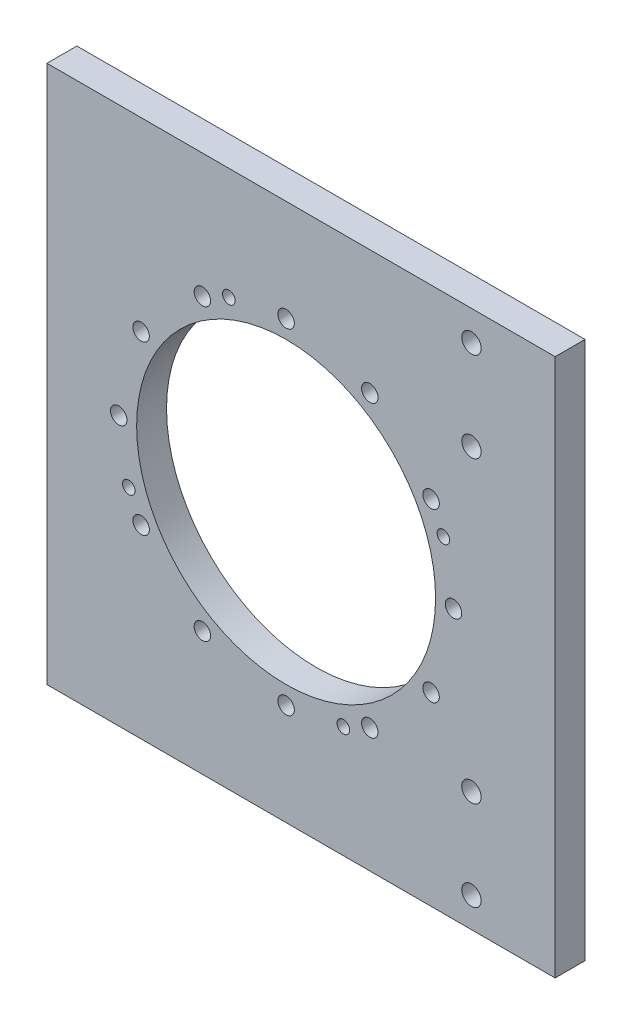
from build123d import *

# Parameters (mm, degrees)
SKETCH_1_W          = 170
SKETCH_1_H          = 180
EXTRUDE_1_DEPTH     = 10
SKETCH_2_R          = 50
SKETCH_2_R_2        = 2.75
SKETCH_2_R_3        = 2.1
SKETCH_2_R_4        = 3.25
CUT_EXTRUDE_1_DEPTH = 11


with BuildPart() as part:
    # 草图1 → 凸台-拉伸1 (new body)
    with BuildSketch(Plane.XY):
        with Locations((5, 0)):
            Rectangle(SKETCH_1_W, SKETCH_1_H)
    extrude(amount=EXTRUDE_1_DEPTH)

    # 草图2 → 切除-拉伸1 (cut)
    with BuildSketch(Plane(origin=(0, 0, 0), x_dir=(-1, 0, 0), z_dir=(0, 0, -1))):
        Circle(SKETCH_2_R)
        with Locations((-56, 0)):
            Circle(SKETCH_2_R_2)
        with Locations((-48.497422612, 28)):
            Circle(SKETCH_2_R_2)
        with Locations((-28, 48.497422612)):
            Circle(SKETCH_2_R_2)
        with Locations((0, 56)):
            Circle(SKETCH_2_R_2)
        with Locations((28, 48.497422612)):
            Circle(SKETCH_2_R_2)
        with Locations((48.497422612, 28)):
            Circle(SKETCH_2_R_2)
        with Locations((56, 0)):
            Circle(SKETCH_2_R_2)
        with Locations((48.497422612, -28)):
            Circle(SKETCH_2_R_2)
        with Locations((28, -48.497422612)):
            Circle(SKETCH_2_R_2)
        with Locations((0, -56)):
            Circle(SKETCH_2_R_2)
        with Locations((-28, -48.497422612)):
            Circle(SKETCH_2_R_2)
        with Locations((-48.497422612, -28)):
            Circle(SKETCH_2_R_2)
        with Locations((-52.622786764, 19.153128026)):
            Circle(SKETCH_2_R_3)
        with Locations((19.153128026, 52.622786764)):
            Circle(SKETCH_2_R_3)
        with Locations((52.622786764, -19.153128026)):
            Circle(SKETCH_2_R_3)
        with Locations((-19.153128026, -52.622786764)):
            Circle(SKETCH_2_R_3)
        with Locations((-62, -80)):
            Circle(SKETCH_2_R_4)
        with Locations((-62, -50)):
            Circle(SKETCH_2_R_4)
        with Locations((-62, 50)):
            Circle(SKETCH_2_R_4)
        with Locations((-62, 80)):
            Circle(SKETCH_2_R_4)
    extrude(amount=-CUT_EXTRUDE_1_DEPTH, mode=Mode.SUBTRACT)


solid = part.part
